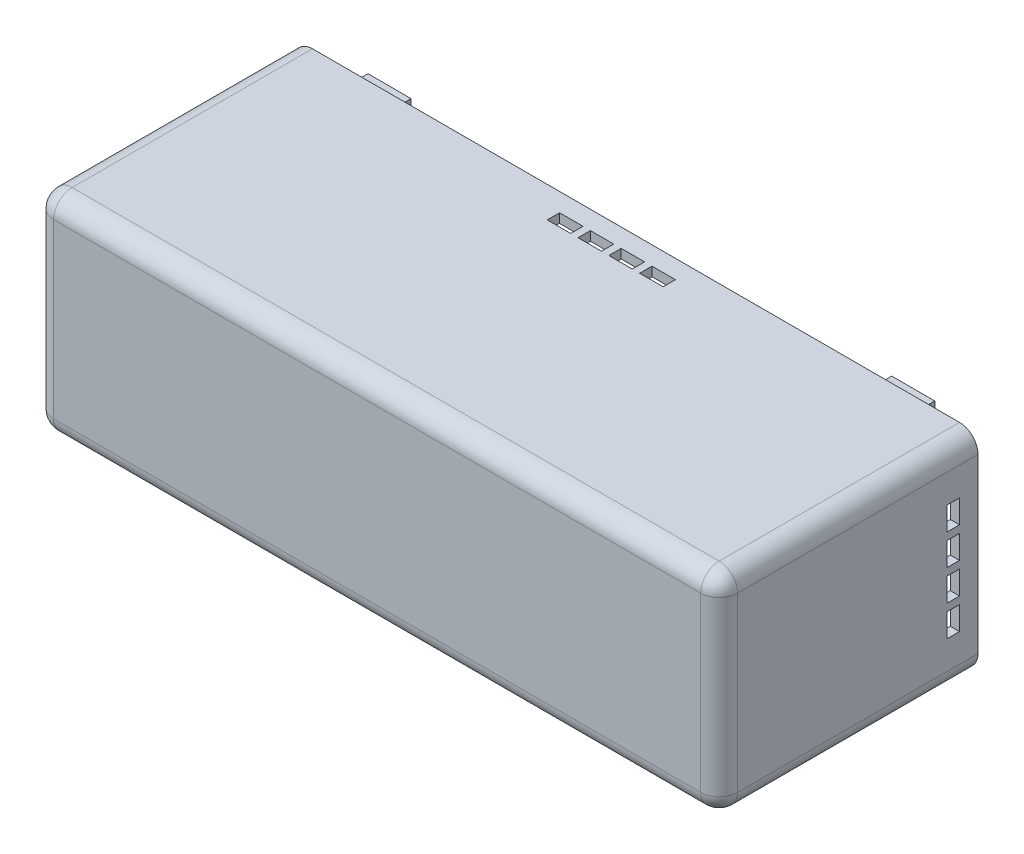
from build123d import *

# Parameters (mm, degrees)
SKETCH1_W             = 111
SKETCH1_H             = 42
BOSS_EXTRUDE1_DEPTH   = 34
FILLET1_R             = 3
SHELL1_T              = -1.5
SKETCH2_W             = 7
SKETCH2_H             = 1
BOSS_EXTRUDE2_DEPTH   = 2.5
BOSS_EXTRUDE2_2_DEPTH = 2.5
BOSS_EXTRUDE2_3_DEPTH = 2.5
SKETCH3_W             = 7
SKETCH3_H             = 1
BOSS_EXTRUDE3_DEPTH   = 4.5
BOSS_EXTRUDE4_DEPTH   = 7
BOSS_EXTRUDE5_DEPTH   = 7
BOSS_EXTRUDE6_DEPTH   = 7
SKETCH7_W             = 7
SKETCH7_H             = 1.5
BOSS_EXTRUDE7_DEPTH   = 1
CUT_EXTRUDE1_REACH    = 149.537
BOSS_EXTRUDE8_DEPTH   = 7
CUT_EXTRUDE3_REACH    = 156.227
SKETCH10_W            = 2
SKETCH10_H            = 3.8
SKETCH11_W            = 3.8
SKETCH11_H            = 2
CUT_EXTRUDE4_DEPTH    = 1.5
SKETCH12_W            = 3.8
SKETCH12_H            = 2
CUT_EXTRUDE5_DEPTH    = 1.5


with BuildPart() as part:
    # Sketch1 → Boss-Extrude1 (new body)
    with BuildSketch(Plane(origin=(0, 0, 0), x_dir=(1, 0, 0), z_dir=(0, 1, 0))):
        with Locations((-152.292726369, -80.532812689)):
            Rectangle(SKETCH1_W, SKETCH1_H)
    extrude(amount=BOSS_EXTRUDE1_DEPTH)

    # Fillet1
    fillet1_edges = [part.edges().sort_by_distance(p)[0] for p in [
        (-96.792726369, 34, 80.532812689),
        (-152.292726369, 34, 101.532812689),
        (-96.792726369, 0, 80.532812689),
        (-207.792726369, 0, 80.532812689),
        (-152.292726369, 0, 101.532812689),
        (-96.792726369, 17, 101.532812689),
        (-207.792726369, 17, 101.532812689),
        (-207.792726369, 34, 80.532812689),
    ]]
    fillet(fillet1_edges, radius=FILLET1_R)

    # Shell1
    shell1_openings = [part.faces().sort_by_distance(p)[0] for p in [
        (-152.292726369, 17, 59.532812689),
    ]]
    offset(amount=SHELL1_T, openings=shell1_openings, kind=Kind.INTERSECTION)



with BuildPart() as body_2:
    # Sketch2 → Boss-Extrude2 (new body)
    with BuildSketch(Plane(origin=(0, 0, 59.532812689), x_dir=(-1, 0, 0), z_dir=(0, 0, -1))):
        with Locations((109.792726369, 32)):
            Rectangle(SKETCH2_W, SKETCH2_H)
    extrude(amount=BOSS_EXTRUDE2_DEPTH)


with BuildPart() as body_3:
    # Sketch2 → Boss-Extrude2 2 (new body)
    with BuildSketch(Plane(origin=(0, 0, 59.532812689), x_dir=(-1, 0, 0), z_dir=(0, 0, -1))):
        with Locations((194.792726369, 32)):
            Rectangle(SKETCH2_W, SKETCH2_H)
    extrude(amount=BOSS_EXTRUDE2_2_DEPTH)


with BuildPart() as body_4:
    # Sketch2 → Boss-Extrude2 3 (new body)
    with BuildSketch(Plane(origin=(0, 0, 59.532812689), x_dir=(-1, 0, 0), z_dir=(0, 0, -1))):
        with Locations((152.292726369, 2)):
            Rectangle(SKETCH2_W, SKETCH2_H)
    extrude(amount=BOSS_EXTRUDE2_3_DEPTH)


with BuildPart() as part_1:
    add(part.part)

    add(body_2.part)  # Boss-Extrude3 merges body 2

    add(body_3.part)  # Boss-Extrude3 merges body 3

    add(body_4.part)  # Boss-Extrude3 merges body 4
    # Sketch3 → Boss-Extrude3 (add)
    with BuildSketch(Plane(origin=(0, 0, 57.032812689), x_dir=(-1, 0, 0), z_dir=(0, 0, -1))):
        with Locations((194.792726369, 32)):
            Rectangle(SKETCH3_W, SKETCH3_H)
        with Locations((109.792726369, 32)):
            Rectangle(SKETCH3_W, SKETCH3_H)
        with Locations((152.292726369, 2)):
            Rectangle(SKETCH3_W, SKETCH3_H)
    extrude(amount=-BOSS_EXTRUDE3_DEPTH)

    # Sketch4 → Boss-Extrude4 (add)
    with BuildSketch(Plane.ZY.offset(113.292726369)):
        Polygon((61.532812689, 31.5), (61.532812689, 32.5), (63.532812689, 32.5), align=None)
    extrude(amount=-BOSS_EXTRUDE4_DEPTH)

    # Sketch5 → Boss-Extrude5 (add)
    with BuildSketch(Plane(origin=(-191.292726369, 0, 0), x_dir=(0, 0, -1), z_dir=(1, 0, 0))):
        Polygon((-61.532812689, 31.5), (-61.532812689, 32.5), (-63.532812689, 32.5), align=None)
    extrude(amount=-BOSS_EXTRUDE5_DEPTH)

    # Sketch6 → Boss-Extrude6 (add)
    with BuildSketch(Plane.ZY.offset(155.792726369)):
        Polygon((61.532812689, 2.5), (61.532812689, 1.5), (63.532812689, 1.5), align=None)
    extrude(amount=-BOSS_EXTRUDE6_DEPTH)

    # Sketch7 → Boss-Extrude7 (add)
    with BuildSketch(Plane.XZ.offset(-31.5)):
        with Locations((-194.792726369, 57.782812689)):
            Rectangle(SKETCH7_W, SKETCH7_H)
        with Locations((-109.792726369, 57.782812689)):
            Rectangle(SKETCH7_W, SKETCH7_H)
    extrude(amount=BOSS_EXTRUDE7_DEPTH)

    # Cut-Extrude1: up to this face of the body (flat: up to its plane)
    cut_extrude1_end = Plane(part_1.part.faces().sort_by_distance((-106.292726369, 31.80952381, 59.378050785))[0])
    # Sketch8 → Cut-Extrude1 (cut, up to the picked face)
    with BuildSketch(Plane.ZY.offset(198.292726369), mode=Mode.PRIVATE) as cut_extrude1_sk1:
        Polygon((57.032812689, 31.5), (57.782812689, 30.5), (57.032812689, 30.5), align=None)
    cut_extrude1_tool1 = split(extrude(cut_extrude1_sk1.sketch, amount=-CUT_EXTRUDE1_REACH, mode=Mode.PRIVATE), bisect_by=cut_extrude1_end, keep=Keep.BOTH, mode=Mode.PRIVATE)
    # Sketch8 → Cut-Extrude1 (cut, up to the picked face)
    with BuildSketch(Plane.ZY.offset(198.292726369), mode=Mode.PRIVATE) as cut_extrude1_sk2:
        Polygon((58.282812689, 30.5), (58.532812689, 31.5), (58.532812689, 30.5), align=None)
    cut_extrude1_tool2 = split(extrude(cut_extrude1_sk2.sketch, amount=-CUT_EXTRUDE1_REACH, mode=Mode.PRIVATE), bisect_by=cut_extrude1_end, keep=Keep.BOTH, mode=Mode.PRIVATE)
    add(cut_extrude1_tool1.solids().sort_by(Axis((-198.292726, 30.833333, 57.282813), (1, 0, 0)))[0], mode=Mode.SUBTRACT)
    add(cut_extrude1_tool2.solids().sort_by(Axis((-198.292726, 30.833333, 58.449479), (1, 0, 0)))[0], mode=Mode.SUBTRACT)

    # Sketch9 → Boss-Extrude8 (add)
    with BuildSketch(Plane.ZY.offset(155.792726369)):
        Polygon((57.032812689, 2.5), (57.782812689, 3.5), (58.282812689, 3.5), (58.532812689, 2.5), align=None)
    extrude(amount=-BOSS_EXTRUDE8_DEPTH)

    # Cut-Extrude3: up to this face of the body (flat: up to its plane)
    cut_extrude3_end = Plane(part_1.part.faces().sort_by_distance((-207.792726369, 17, 79.032812689))[0])
    # Sketch10 → Cut-Extrude3 (cut, up to the picked face)
    with BuildSketch(Plane(origin=(-96.792726369, 0, 0), x_dir=(0, 0, -1), z_dir=(1, 0, 0)), mode=Mode.PRIVATE) as cut_extrude3_sk1:
        with Locations((-63.532812689, 24.5)):
            Rectangle(SKETCH10_W, SKETCH10_H)
    cut_extrude3_tool1 = split(extrude(cut_extrude3_sk1.sketch, amount=-CUT_EXTRUDE3_REACH, mode=Mode.PRIVATE), bisect_by=cut_extrude3_end, keep=Keep.BOTH, mode=Mode.PRIVATE)
    # Sketch10 → Cut-Extrude3 (cut, up to the picked face)
    with BuildSketch(Plane(origin=(-96.792726369, 0, 0), x_dir=(0, 0, -1), z_dir=(1, 0, 0)), mode=Mode.PRIVATE) as cut_extrude3_sk2:
        with Locations((-63.532812689, 19.5)):
            Rectangle(SKETCH10_W, SKETCH10_H)
    cut_extrude3_tool2 = split(extrude(cut_extrude3_sk2.sketch, amount=-CUT_EXTRUDE3_REACH, mode=Mode.PRIVATE), bisect_by=cut_extrude3_end, keep=Keep.BOTH, mode=Mode.PRIVATE)
    # Sketch10 → Cut-Extrude3 (cut, up to the picked face)
    with BuildSketch(Plane(origin=(-96.792726369, 0, 0), x_dir=(0, 0, -1), z_dir=(1, 0, 0)), mode=Mode.PRIVATE) as cut_extrude3_sk3:
        with Locations((-63.532812689, 14.5)):
            Rectangle(SKETCH10_W, SKETCH10_H)
    cut_extrude3_tool3 = split(extrude(cut_extrude3_sk3.sketch, amount=-CUT_EXTRUDE3_REACH, mode=Mode.PRIVATE), bisect_by=cut_extrude3_end, keep=Keep.BOTH, mode=Mode.PRIVATE)
    # Sketch10 → Cut-Extrude3 (cut, up to the picked face)
    with BuildSketch(Plane(origin=(-96.792726369, 0, 0), x_dir=(0, 0, -1), z_dir=(1, 0, 0)), mode=Mode.PRIVATE) as cut_extrude3_sk4:
        with Locations((-63.532812689, 9.5)):
            Rectangle(SKETCH10_W, SKETCH10_H)
    cut_extrude3_tool4 = split(extrude(cut_extrude3_sk4.sketch, amount=-CUT_EXTRUDE3_REACH, mode=Mode.PRIVATE), bisect_by=cut_extrude3_end, keep=Keep.BOTH, mode=Mode.PRIVATE)
    add(cut_extrude3_tool1.solids().sort_by(Axis((-96.792726, 24.5, 63.532813), (-1, 0, 0)))[0], mode=Mode.SUBTRACT)
    add(cut_extrude3_tool2.solids().sort_by(Axis((-96.792726, 19.5, 63.532813), (-1, 0, 0)))[0], mode=Mode.SUBTRACT)
    add(cut_extrude3_tool3.solids().sort_by(Axis((-96.792726, 14.5, 63.532813), (-1, 0, 0)))[0], mode=Mode.SUBTRACT)
    add(cut_extrude3_tool4.solids().sort_by(Axis((-96.792726, 9.5, 63.532813), (-1, 0, 0)))[0], mode=Mode.SUBTRACT)

    # Sketch11 → Cut-Extrude4 (cut)
    with BuildSketch(Plane(origin=(0, 34, 0), x_dir=(1, 0, 0), z_dir=(0, 1, 0))):
        with Locations((-159.792726369, -63.532812689)):
            Rectangle(SKETCH11_W, SKETCH11_H)
        with Locations((-154.792726369, -63.532812689)):
            Rectangle(SKETCH11_W, SKETCH11_H)
        with Locations((-149.792726369, -63.532812689)):
            Rectangle(SKETCH11_W, SKETCH11_H)
        with Locations((-144.792726369, -63.532812689)):
            Rectangle(SKETCH11_W, SKETCH11_H)
    extrude(amount=-CUT_EXTRUDE4_DEPTH, mode=Mode.SUBTRACT)

    # Sketch12 → Cut-Extrude5 (cut)
    with BuildSketch(Plane.XZ):
        with Locations((-123.542726369, 63.532812689)):
            Rectangle(SKETCH12_W, SKETCH12_H)
        with Locations((-128.542726369, 63.532812689)):
            Rectangle(SKETCH12_W, SKETCH12_H)
        with Locations((-176.042726369, 63.532812689)):
            Rectangle(SKETCH12_W, SKETCH12_H)
        with Locations((-181.042726369, 63.532812689)):
            Rectangle(SKETCH12_W, SKETCH12_H)
    extrude(amount=-CUT_EXTRUDE5_DEPTH, mode=Mode.SUBTRACT)


solid = part_1.part
